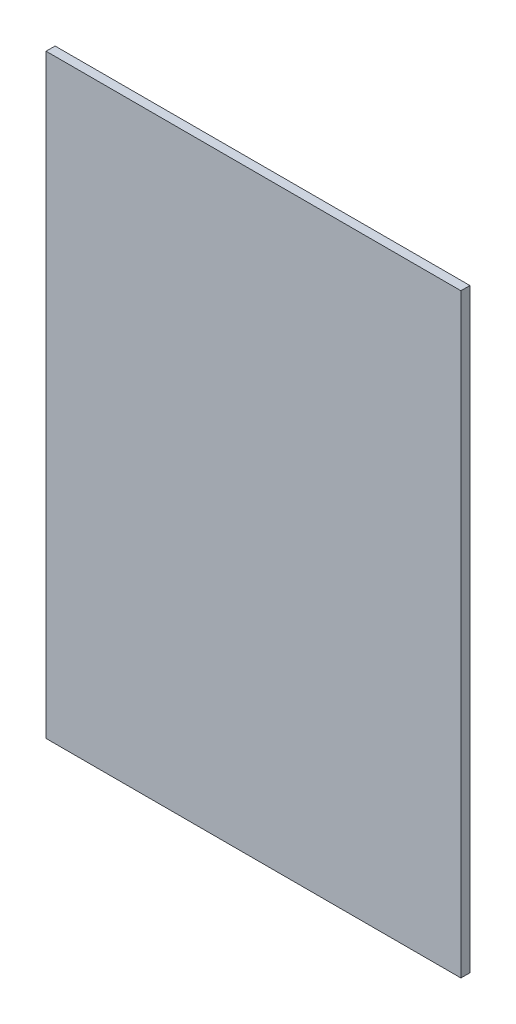
from build123d import *

# Parameters (mm, degrees)
CROQUIS1_W              = 460
CROQUIS1_H              = 660
SALIENTE_EXTRUIR1_DEPTH = 10
VACIADO1_T              = -2


with BuildPart() as part:
    # Croquis1 → Saliente-Extruir1 (new body)
    with BuildSketch(Plane.XY):
        Rectangle(CROQUIS1_W, CROQUIS1_H)
    extrude(amount=SALIENTE_EXTRUIR1_DEPTH)

    # Vaciado1
    vaciado1_openings = [part.faces().sort_by_distance(p)[0] for p in [
        (0, 0, 0),
    ]]
    offset(amount=VACIADO1_T, openings=vaciado1_openings, kind=Kind.INTERSECTION)


solid = part.part
